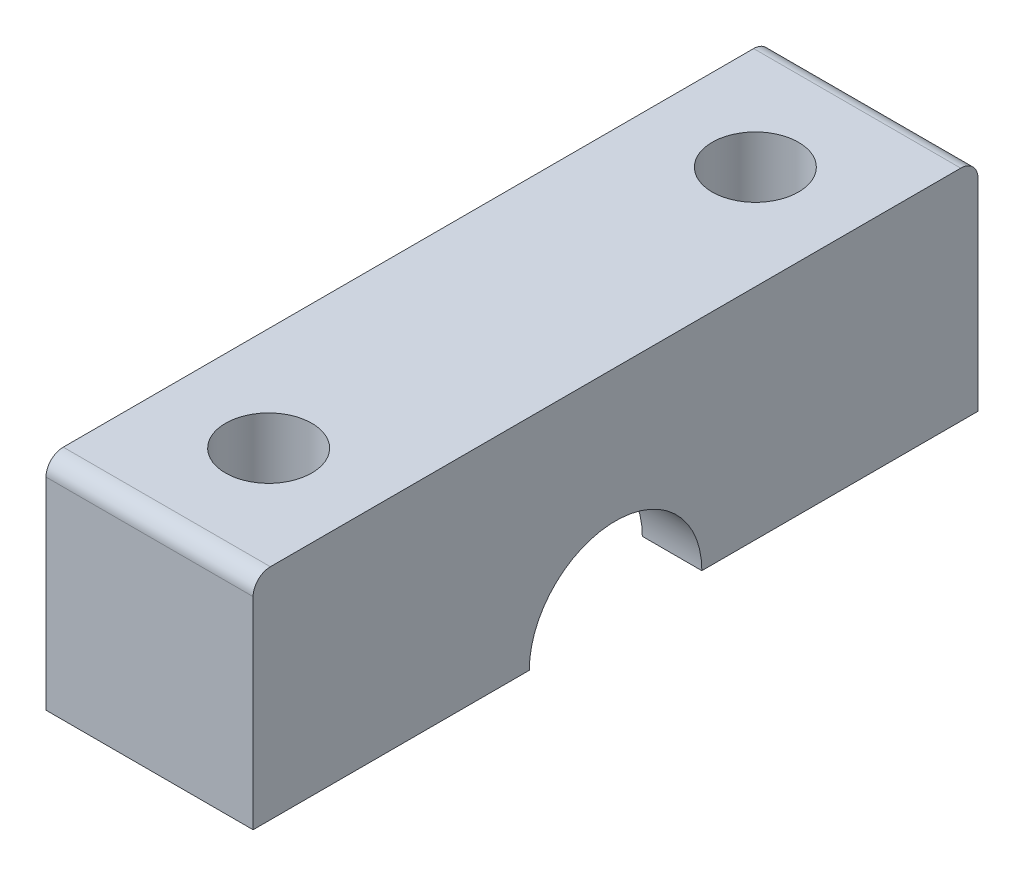
from build123d import *

# Parameters (mm, degrees)
BOSS_EXTRUDE1_DEPTH = 12
SKETCH2_R           = 8.5
CUT_EXTRUDE1_DEPTH  = 2.55
CUT_EXTRUDE2_REACH  = 111.203
SKETCH3_R           = 2.5
FILLET1_R           = 1


with BuildPart() as part:
    # Sketch1 → Boss-Extrude1 (new body)
    with BuildSketch(Plane(origin=(100, 0, 0), x_dir=(0, 0, -1), z_dir=(1, 0, 0))):
        with BuildLine():
            Line((0, 23), (0, 35.7))
            Line((0, 35.7), (42, 35.7))
            Line((42, 35.7), (42, 23))
            Line((42, 23), (26, 23))
            ThreePointArc((26, 23), (21, 28), (16, 23))
            Line((16, 23), (0, 23))
        make_face()
    extrude(amount=-BOSS_EXTRUDE1_DEPTH)

    # Sketch2 → Cut-Extrude1 (cut, symmetric)
    with BuildSketch(Plane(origin=(94, 0, 0), x_dir=(0, 0, -1), z_dir=(1, 0, 0))):
        with Locations((21, 23)):
            Circle(SKETCH2_R)
    extrude(amount=CUT_EXTRUDE1_DEPTH, both=True, mode=Mode.SUBTRACT)

    # Sketch3 → Cut-Extrude2 (cut, up to next)
    with BuildSketch(Plane(origin=(0, 35.7, 0), x_dir=(1, 0, 0), z_dir=(0, 1, 0)), mode=Mode.PRIVATE) as cut_extrude2_sk1:
        with Locations(Location((94, 35.1, 0), (0, 0, 270))):
            Circle(SKETCH3_R)
    cut_extrude2_tool1 = extrude(cut_extrude2_sk1.sketch, amount=-CUT_EXTRUDE2_REACH, mode=Mode.PRIVATE) & part.part
    # Sketch3 → Cut-Extrude2 (cut, up to next)
    with BuildSketch(Plane(origin=(0, 35.7, 0), x_dir=(1, 0, 0), z_dir=(0, 1, 0)), mode=Mode.PRIVATE) as cut_extrude2_sk2:
        with Locations(Location((94, 6.9, 0), (0, 0, 270))):
            Circle(SKETCH3_R)
    cut_extrude2_tool2 = extrude(cut_extrude2_sk2.sketch, amount=-CUT_EXTRUDE2_REACH, mode=Mode.PRIVATE) & part.part
    add(cut_extrude2_tool1.solids().sort_by_distance((94, 35.7, -35.1))[0], mode=Mode.SUBTRACT)
    add(cut_extrude2_tool2.solids().sort_by_distance((94, 35.7, -6.9))[0], mode=Mode.SUBTRACT)

    # Fillet1
    fillet1_edges = [part.edges().sort_by_distance(p)[0] for p in [
        (94, 35.7, 0),
        (94, 35.7, -42),
    ]]
    fillet(fillet1_edges, radius=FILLET1_R)


solid = part.part
